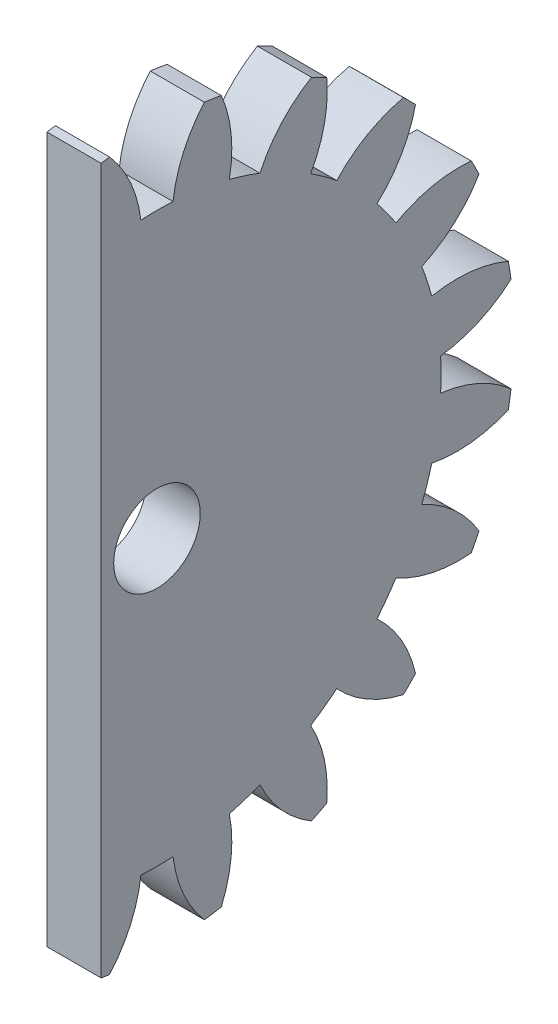
from build123d import *

# Parameters (mm, degrees)
BASPROSKE_W        = 2.5
BASPROSKE_H        = 16.5
TOOTHCUT_DEPTH     = 24.468063405
TEETHCUTS_COUNT    = 20
TEETHCUTS_ANGLE    = 342
BORSKE_R           = 2
BORE_DEPTH         = 50.0000508
SKETCH1_W          = 14.029900708
SKETCH1_H          = 46.240429445
CUT_EXTRUDE1_DEPTH = 24.26283946


with BuildPart() as part:
    # BasProSke → Base-Revolve (revolve)
    with BuildSketch(Plane(origin=(0, 0, 0), x_dir=(1, 0, 0), z_dir=(0, 1, 0)), mode=Mode.PRIVATE) as base_revolve_sk:
        with Locations((1.25, 8.25)):
            Rectangle(BASPROSKE_W, BASPROSKE_H)
    revolve(base_revolve_sk.sketch.rotate(Axis((-10, 0, 0), (1, 0, 0)), 180), axis=Axis((-10, 0, 0), (1, 0, 0)))

    # TooCutSke → ToothCut (cut, through all)
    with BuildSketch(Plane(origin=(0, 0, 0), x_dir=(0, 0, -1), z_dir=(1, 0, 0))):
        with BuildLine():
            ThreePointArc((0.74381438, 13.102904875), (0, 13.124), (-0.74381438, 13.102904875))
            ThreePointArc((-0.74381438, 13.102904875), (-1.226473103, 14.852072512), (-2.209965745, 16.376962373))
            ThreePointArc((-2.209965745, 16.376962373), (0, 16.5254), (2.209965745, 16.376962373))
            ThreePointArc((2.209965745, 16.376962373), (1.226473103, 14.852072512), (0.74381438, 13.102904875))
        make_face()
    toothcut = extrude(amount=TOOTHCUT_DEPTH, mode=Mode.SUBTRACT)

    # TeethCuts: ToothCut ×20 about axis
    teethcuts_axis = Axis((-10, 0, 0), (1, 0, 0))
    for i in range(1, TEETHCUTS_COUNT):
        add(toothcut.rotate(teethcuts_axis, i * TEETHCUTS_ANGLE / (TEETHCUTS_COUNT - 1)), mode=Mode.SUBTRACT)

    # BorSke → Bore (cut, symmetric)
    with BuildSketch(Plane(origin=(0, 0, 0), x_dir=(0, 0, -1), z_dir=(1, 0, 0))):
        with Locations(Location((0, 0, 0), (0, 0, 180))):
            Circle(BORSKE_R)
    extrude(amount=BORE_DEPTH, both=True, mode=Mode.SUBTRACT)

    # Sketch1 → Cut-Extrude1 (cut, through all)
    with BuildSketch(Plane(origin=(2.5, 0, 0), x_dir=(0, 0, -1), z_dir=(1, 0, 0))):
        with Locations((-9.596119027, 6.823357103)):
            Rectangle(SKETCH1_W, SKETCH1_H)
    extrude(amount=-CUT_EXTRUDE1_DEPTH, mode=Mode.SUBTRACT)


solid = part.part
